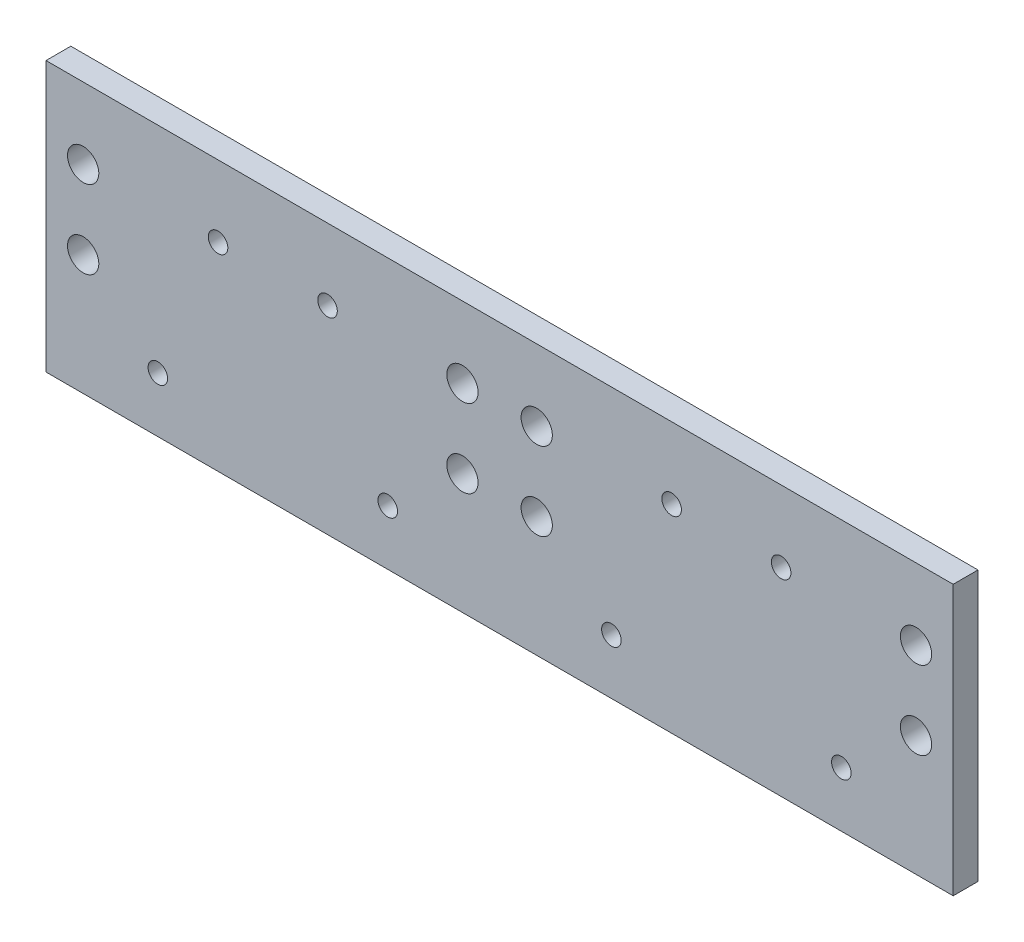
from build123d import *

# Parameters (mm, degrees)
SKETCH1_W           = 116
SKETCH1_H           = 34.5
BOSS_EXTRUDE1_DEPTH = 3.175
SKETCH2_R           = 2
SKETCH2_R_2         = 1.25
CUT_EXTRUDE1_DEPTH  = 95.79098388


with BuildPart() as part:
    # Sketch1 → Boss-Extrude1 (new body)
    with BuildSketch(Plane.XY):
        with Locations((-29, -20.25)):
            Rectangle(SKETCH1_W, SKETCH1_H)
    extrude(amount=BOSS_EXTRUDE1_DEPTH)

    # Sketch2 → Cut-Extrude1 (cut, through all)
    with BuildSketch(Plane(origin=(0, 0, 0), x_dir=(-1, 0, 0), z_dir=(0, 0, -1))):
        with Locations((-24.25, -22.13)):
            Circle(SKETCH2_R)
        with Locations((-24.25, -12.13)):
            Circle(SKETCH2_R)
        with Locations((24.25, -12.13)):
            Circle(SKETCH2_R)
        with Locations((24.25, -22.13)):
            Circle(SKETCH2_R)
        with Locations((33.75, -12.13)):
            Circle(SKETCH2_R)
        with Locations((33.75, -22.13)):
            Circle(SKETCH2_R)
        with Locations((82.25, -12.13)):
            Circle(SKETCH2_R)
        with Locations((82.25, -22.13)):
            Circle(SKETCH2_R)
        with Locations((72.699747468, -30.449747468)):
            Circle(SKETCH2_R_2)
        with Locations((65, -12.13)):
            Circle(SKETCH2_R_2)
        with Locations((51, -12.13)):
            Circle(SKETCH2_R_2)
        with Locations((43.300252532, -30.449747468)):
            Circle(SKETCH2_R_2)
        with Locations((14.699747468, -30.449747468)):
            Circle(SKETCH2_R_2)
        with Locations((7, -12.13)):
            Circle(SKETCH2_R_2)
        with Locations((-7, -12.13)):
            Circle(SKETCH2_R_2)
        with Locations((-14.699747468, -30.449747468)):
            Circle(SKETCH2_R_2)
    extrude(amount=-CUT_EXTRUDE1_DEPTH, mode=Mode.SUBTRACT)


solid = part.part
